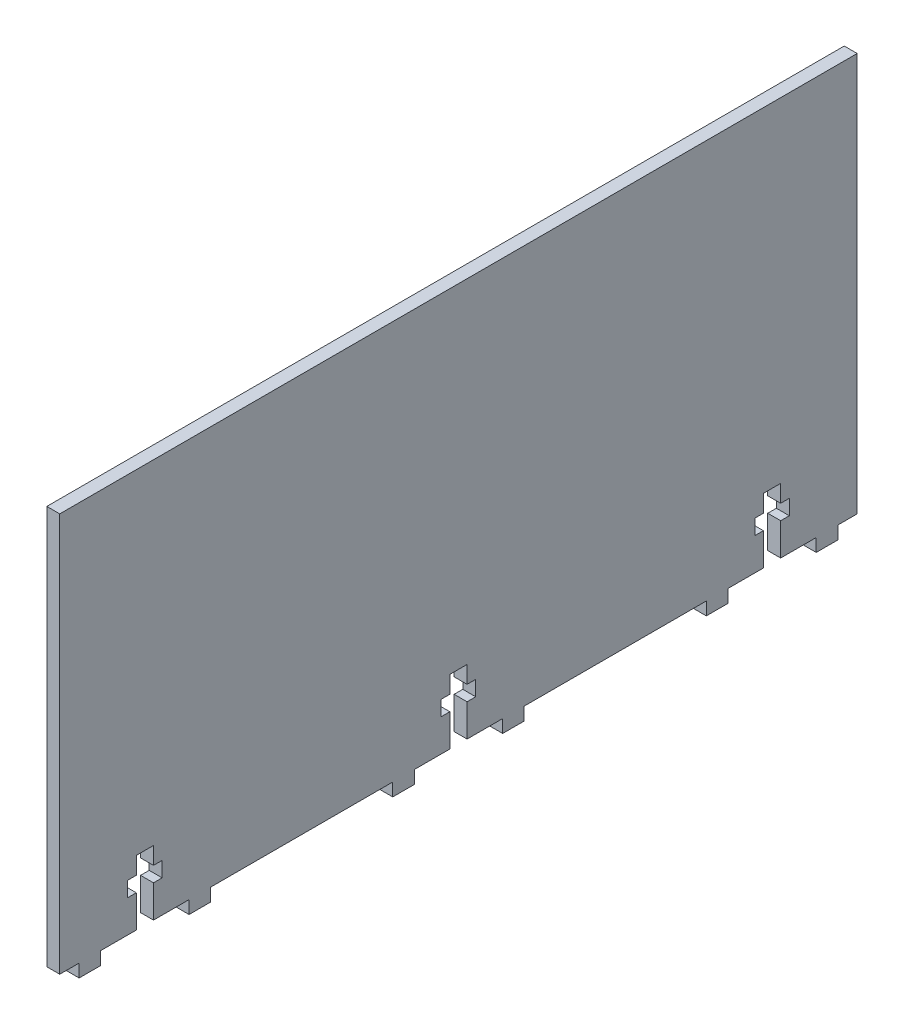
from build123d import *

# Parameters (mm, degrees)
BOSS_EXTRUDE1_DEPTH = 3


with BuildPart() as part:
    # Sketch1 → Boss-Extrude1 (new, symmetric)
    with BuildSketch(Plane(origin=(0, 0, 0), x_dir=(0, 0, -1), z_dir=(1, 0, 0))):
        Polygon((185, 92.5), (-185, 92.5), (-185, -92.5), (-176, -92.5), (-176, -98.5), (-166, -98.5), (-166, -92.5), (-149.5, -92.5), (-149.5, -77.5), (-153.5, -77.5), (-153.5, -70.5), (-149.5, -70.5), (-149.5, -62.5), (-141.5, -62.5), (-141.5, -70.5), (-137.5, -70.5), (-137.5, -77.5), (-141.5, -77.5), (-141.5, -92.5), (-125, -92.5), (-125, -98.5), (-115, -98.5), (-115, -92.5), (-30.5, -92.5), (-30.5, -98.5), (-20.5, -98.5), (-20.5, -92.5), (-4, -92.5), (-4, -77.5), (-8, -77.5), (-8, -70.5), (-4, -70.5), (-4, -62.5), (4, -62.5), (4, -70.5), (8, -70.5), (8, -77.5), (4, -77.5), (4, -92.5), (20.5, -92.5), (20.5, -98.5), (30.5, -98.5), (30.5, -92.5), (115, -92.5), (115, -98.5), (125, -98.5), (125, -92.5), (141.5, -92.5), (141.5, -77.5), (137.5, -77.5), (137.5, -70.5), (141.5, -70.5), (141.5, -62.5), (149.5, -62.5), (149.5, -70.5), (153.5, -70.5), (153.5, -77.5), (149.5, -77.5), (149.5, -92.5), (166, -92.5), (166, -98.5), (176, -98.5), (176, -92.5), (185, -92.5), align=None)
    extrude(amount=BOSS_EXTRUDE1_DEPTH, both=True)


solid = part.part
